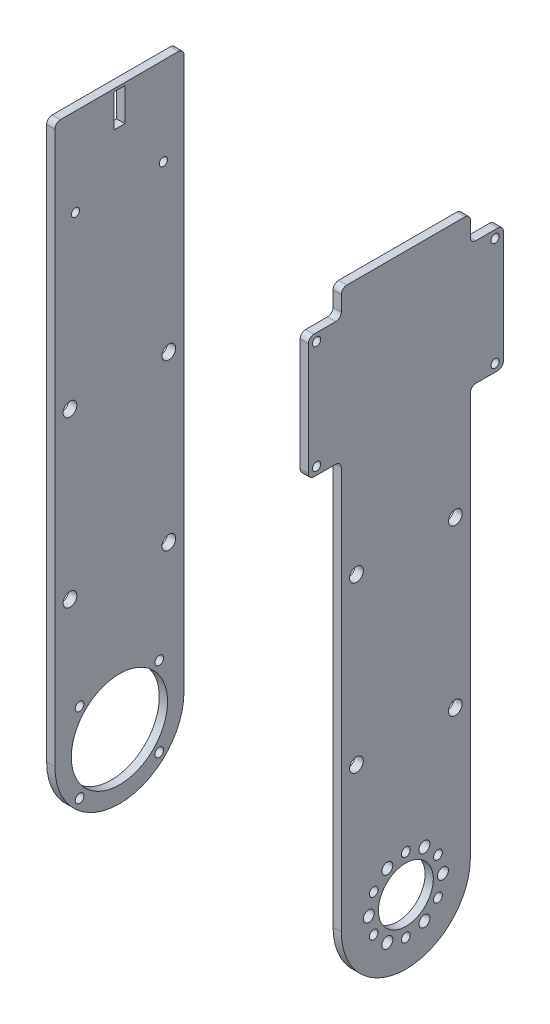
from build123d import *

# Parameters (mm, degrees)
SKETCH_1_W           = 101.3
SKETCH_1_H           = 47
EXTRUDE_1_DEPTH      = 3
SKETCH_2_W           = 47
SKETCH_2_H           = 3
SKETCH_2_R           = 23.5
EXTRUDE_2_DEPTH      = 3
EXTRUDE_START        = 3
SKETCH_3_W           = 47
SKETCH_3_H           = 3
SKETCH_3_R           = 23.5
EXTRUDE_3_DEPTH      = 3
SKETCH_5_R           = 2
CUT_EXTRUDE_2_DEPTH  = 3
SKETCH_6_R           = 1.5
CUT_EXTRUDE_3_DEPTH  = 3
SKETCH_7_R           = 17.52
SKETCH_7_R_2         = 1.6
CUT_EXTRUDE_4_DEPTH  = 3
SKETCH_8_R           = 10
SKETCH_8_R_2         = 1.6
SKETCH_8_R_3         = 2
CUT_EXTRUDE_5_DEPTH  = 3
SKETCH_15_R          = 10
CUT_EXTRUDE_10_DEPTH = 10
SKETCH_16_W          = 101.3
SKETCH_16_H          = 47
CUT_EXTRUDE_11_DEPTH = 10
FILLET_1_R           = 2
FILLET_2_R           = 2
SKETCH_18_R          = 1.5
SKETCH_18_W          = 4
SKETCH_18_H          = 12
CUT_EXTRUDE_13_DEPTH = 3
SKETCH_24_W          = 12
SKETCH_24_H          = 45
EXTRUDE_7_DEPTH      = 3
SKETCH_25_R          = 1.5
CUT_EXTRUDE_15_DEPTH = 251.451172886
FILLET_4_R           = 2
SKETCH_27_R          = 2.5
CUT_EXTRUDE_16_DEPTH = 251.451172886


with BuildPart() as part:
    # 草图1 → 凸台-拉伸1 (new body)
    with BuildSketch(Plane(origin=(0, 0, 0), x_dir=(1, 0, 0), z_dir=(0, 1, 0))):
        Rectangle(SKETCH_1_W, SKETCH_1_H)
    extrude(amount=EXTRUDE_1_DEPTH)

    # 草图2 → 凸台-拉伸2 (add)
    with BuildSketch(Plane.ZY.offset(50.65)):
        with BuildLine():
            Line((23.5, 0), (-23.5, 0))
            Line((-23.5, 0), (-23.5, -200))
            ThreePointArc((-23.5, -200), (0, -176.5), (23.5, -200))
            Line((23.5, -200), (23.5, 0))
        make_face()
        with Locations((0, 1.5)):
            Rectangle(SKETCH_2_W, SKETCH_2_H)
        with Locations((0, -200)):
            Circle(SKETCH_2_R)
    extrude(amount=EXTRUDE_2_DEPTH)

    # 草图3 → 凸台-拉伸3 (add)
    with BuildSketch(Plane(origin=(50.65, 0, 0), x_dir=(0, 0, -1), z_dir=(1, 0, 0)).offset(EXTRUDE_START)):
        with BuildLine():
            Line((23.5, 0), (-23.5, 0))
            Line((-23.5, 0), (-23.5, -200))
            ThreePointArc((-23.5, -200), (0, -176.5), (23.5, -200))
            Line((23.5, -200), (23.5, 0))
        make_face()
        with Locations((0, 1.5)):
            Rectangle(SKETCH_3_W, SKETCH_3_H)
        with Locations((0, -200)):
            Circle(SKETCH_3_R)
    extrude(amount=-EXTRUDE_3_DEPTH)

    # 草图5 → 切除-拉伸2 (cut)
    with BuildSketch(Plane(origin=(0, 3, 0), x_dir=(1, 0, 0), z_dir=(0, 1, 0))):
        with Locations(Location((21.650635095, -12.5, 0), (0, 0, 270))):
            Circle(SKETCH_5_R)
        with Locations((0, -25)):
            Circle(SKETCH_5_R)
        with Locations(Location((-21.650635095, -12.5, 0), (0, 0, 270))):
            Circle(SKETCH_5_R)
        with Locations(Location((-21.650635095, 12.5, 0), (0, 0, 270))):
            Circle(SKETCH_5_R)
        with Locations((0, 25)):
            Circle(SKETCH_5_R)
        with Locations(Location((21.650635095, 12.5, 0), (0, 0, 270))):
            Circle(SKETCH_5_R)
    extrude(amount=-CUT_EXTRUDE_2_DEPTH, mode=Mode.SUBTRACT)

    # 草图6 → 切除-拉伸3 (cut)
    with BuildSketch(Plane(origin=(0, 3, 0), x_dir=(1, 0, 0), z_dir=(0, 1, 0))):
        with Locations((-6.470476128, 24.148145657)):
            Circle(SKETCH_6_R)
        with Locations((6.470476128, -24.148145657)):
            Circle(SKETCH_6_R)
        with Locations((-6.470476128, -24.148145657)):
            Circle(SKETCH_6_R)
        with Locations((6.470476128, 24.148145657)):
            Circle(SKETCH_6_R)
    extrude(amount=-CUT_EXTRUDE_3_DEPTH, mode=Mode.SUBTRACT)

    # 草图7 → 切除-拉伸4 (cut)
    with BuildSketch(Plane.ZY.offset(53.65)):
        with Locations((0, -200)):
            Circle(SKETCH_7_R)
        with Locations((14.495689014, -185.504310986)):
            Circle(SKETCH_7_R_2)
        with Locations((14.495689014, -214.495689014)):
            Circle(SKETCH_7_R_2)
        with Locations((-14.495689014, -214.495689014)):
            Circle(SKETCH_7_R_2)
        with Locations((-14.495689014, -185.504310986)):
            Circle(SKETCH_7_R_2)
    extrude(amount=-CUT_EXTRUDE_4_DEPTH, mode=Mode.SUBTRACT)

    # 草图8 → 切除-拉伸5 (cut)
    with BuildSketch(Plane(origin=(53.65, 0, 0), x_dir=(0, 0, -1), z_dir=(1, 0, 0))):
        with Locations((0, -200)):
            Circle(SKETCH_8_R)
        with Locations((0, -213.5)):
            Circle(SKETCH_8_R_2)
        with Locations((-11.691342951, -206.75)):
            Circle(SKETCH_8_R_2)
        with Locations((-11.691342951, -193.25)):
            Circle(SKETCH_8_R_2)
        with Locations((0, -186.5)):
            Circle(SKETCH_8_R_2)
        with Locations((11.691342951, -193.25)):
            Circle(SKETCH_8_R_2)
        with Locations((11.691342951, -206.75)):
            Circle(SKETCH_8_R_2)
        with Locations((13.5, -200)):
            Circle(SKETCH_8_R_3)
        with Locations((6.75, -211.691342951)):
            Circle(SKETCH_8_R_3)
        with Locations((-6.75, -211.691342951)):
            Circle(SKETCH_8_R_3)
        with Locations((-13.5, -200)):
            Circle(SKETCH_8_R_3)
        with Locations((-6.75, -188.308657049)):
            Circle(SKETCH_8_R_3)
        with Locations((6.75, -188.308657049)):
            Circle(SKETCH_8_R_3)
    extrude(amount=-CUT_EXTRUDE_5_DEPTH, mode=Mode.SUBTRACT)

    # 草图15 → 切除-拉伸10 (cut)
    with BuildSketch(Plane(origin=(0, 3, 0), x_dir=(1, 0, 0), z_dir=(0, 1, 0))):
        with Locations(Location((0, 0, 0), (0, 0, 270))):
            Circle(SKETCH_15_R)
    extrude(amount=-CUT_EXTRUDE_10_DEPTH, mode=Mode.SUBTRACT)

    # 草图16 → 切除-拉伸11 (cut)
    with BuildSketch(Plane.XZ):
        Rectangle(SKETCH_16_W, SKETCH_16_H)
    extrude(amount=-CUT_EXTRUDE_11_DEPTH, mode=Mode.SUBTRACT)


with BuildPart() as cut_extrude_11_piece_1:
    # of the separate pieces the step leaves, piece 1, a body of its own (cut_extrude_11_pieces)
    add(part.part.solids().sort_by_distance((50.65, 3, -23.5))[0])

    # 圆角2
    fillet_2_edges = [cut_extrude_11_piece_1.edges().sort_by_distance(p)[0] for p in [
        (52.15, 3, -23.5),
        (52.15, 3, 23.5),
    ]]
    fillet(fillet_2_edges, radius=FILLET_2_R)

    # 草图24 → 凸台-拉伸7 (add)
    with BuildSketch(Plane(origin=(53.65, 0, 0), x_dir=(0, 0, -1), z_dir=(1, 0, 0))):
        with Locations((-29.5, -29)):
            Rectangle(SKETCH_24_W, SKETCH_24_H)
        with Locations((29.5, -29)):
            Rectangle(SKETCH_24_W, SKETCH_24_H)
    extrude(amount=-EXTRUDE_7_DEPTH)

    # 草图25 → 切除-拉伸15 (cut, through all)
    with BuildSketch(Plane(origin=(53.65, 0, 0), x_dir=(0, 0, -1), z_dir=(1, 0, 0))):
        with Locations((-32.5, -9.308631332)):
            Circle(SKETCH_25_R)
        with Locations((-32.5, -48.691368668)):
            Circle(SKETCH_25_R)
        with Locations((32.5, -9.308631332)):
            Circle(SKETCH_25_R)
        with Locations((32.5, -48.691368668)):
            Circle(SKETCH_25_R)
    extrude(amount=-CUT_EXTRUDE_15_DEPTH, mode=Mode.SUBTRACT)

    # 圆角4
    fillet_4_edges = [cut_extrude_11_piece_1.edges().sort_by_distance(p)[0] for p in [
        (52.15, -6.5, 23.5),
        (52.15, -51.5, 23.5),
        (52.15, -51.5, 35.5),
        (52.15, -6.5, 35.5),
        (52.15, -51.5, -23.5),
        (52.15, -6.5, -23.5),
        (52.15, -6.5, -35.5),
        (52.15, -51.5, -35.5),
    ]]
    fillet(fillet_4_edges, radius=FILLET_4_R)


with BuildPart() as cut_extrude_11_piece_2:
    # of the separate pieces the step leaves, piece 2, a body of its own (cut_extrude_11_pieces)
    add(part.part.solids().sort_by_distance((-50.65, 3, 23.5))[0])

    # 圆角1
    fillet_1_edges = [cut_extrude_11_piece_2.edges().sort_by_distance(p)[0] for p in [
        (-52.15, 3, 23.5),
        (-52.15, 3, -23.5),
    ]]
    fillet(fillet_1_edges, radius=FILLET_1_R)

    # 草图18 → 切除-拉伸13 (cut)
    with BuildSketch(Plane.ZY.offset(53.65)):
        with Locations((-16, -29)):
            Circle(SKETCH_18_R)
        with Locations((16, -29)):
            Circle(SKETCH_18_R)
        with Locations((0, -4)):
            Rectangle(SKETCH_18_W, SKETCH_18_H)
    extrude(amount=-CUT_EXTRUDE_13_DEPTH, mode=Mode.SUBTRACT)


with BuildPart() as cut_extrude_16_tool:
    # 草图27 → 切除-拉伸16 (new, through all)
    with BuildSketch(Plane.ZY.offset(53.65)):
        with Locations((-18, -150)):
            Circle(SKETCH_27_R)
        with Locations((-18, -90)):
            Circle(SKETCH_27_R)
        with Locations(Location((18, -150, 0), (0, 0, 180))):
            Circle(SKETCH_27_R)
        with Locations(Location((18, -90, 0), (0, 0, 180))):
            Circle(SKETCH_27_R)
    extrude(amount=-CUT_EXTRUDE_16_DEPTH)


with BuildPart() as cut_extrude_11_piece_1_1:
    add(cut_extrude_11_piece_1.part)

    # 切除-拉伸16: cut by cut_extrude_16_tool
    add(cut_extrude_16_tool.part, mode=Mode.SUBTRACT)


with BuildPart() as cut_extrude_11_piece_2_1:
    add(cut_extrude_11_piece_2.part)

    # 切除-拉伸16: cut by cut_extrude_16_tool
    add(cut_extrude_16_tool.part, mode=Mode.SUBTRACT)


solid = Compound([cut_extrude_11_piece_1_1.part, cut_extrude_11_piece_2_1.part])
